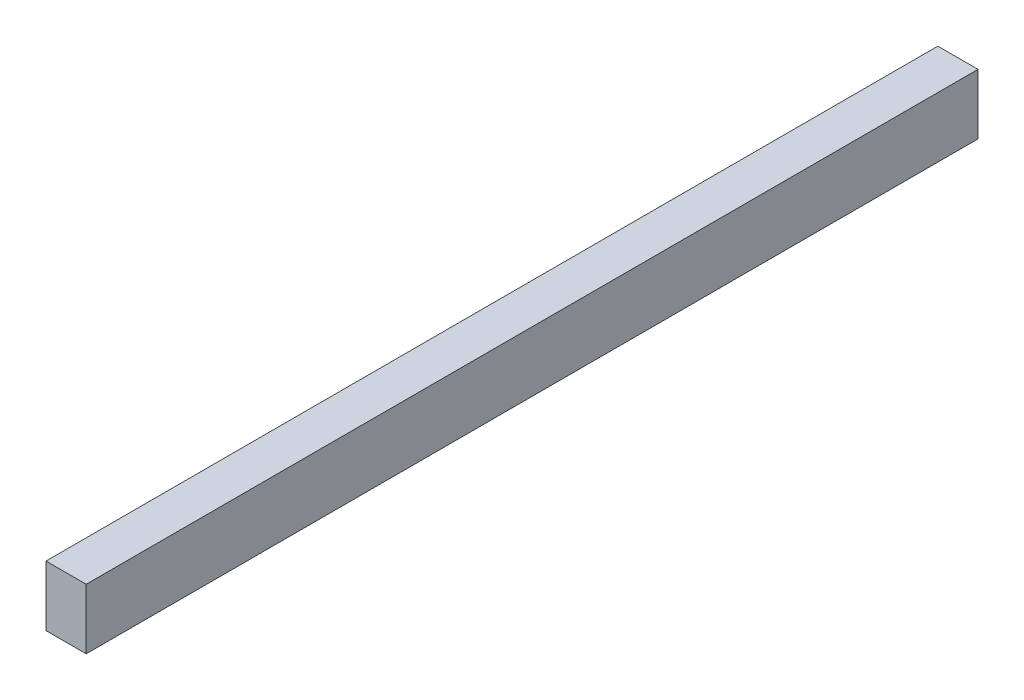
from build123d import *

# Parameters (mm, degrees)
SZKIC1_W                    = 100
SZKIC1_H                    = 150
DODANIE_WYCI_GNI_CIE1_DEPTH = 2220


with BuildPart() as part:
    # Szkic1 → Dodanie-wyciągnięcie1 (new body)
    with BuildSketch(Plane.XY):
        with Locations((50, 75)):
            Rectangle(SZKIC1_W, SZKIC1_H)
    extrude(amount=DODANIE_WYCI_GNI_CIE1_DEPTH)


solid = part.part
